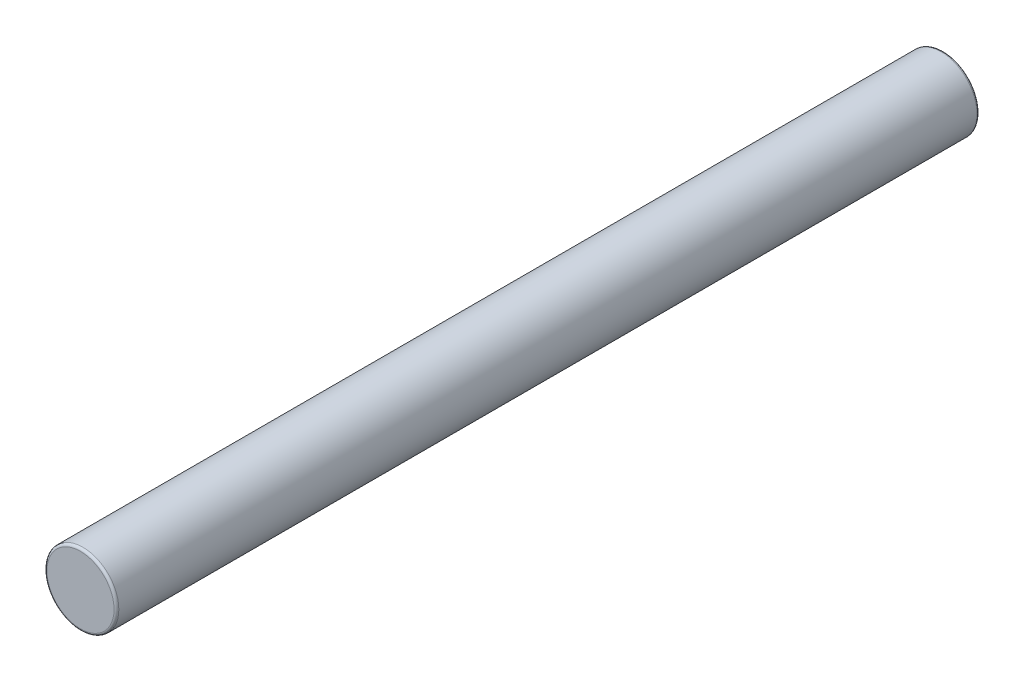
from build123d import *

# Parameters (mm, degrees)
SKETCH1_R      = 1.5
EXTRUDE1_DEPTH = 36
FILLET1_R      = 0.1


with BuildPart() as part:
    # Sketch1 → Extrude1 (new body)
    with BuildSketch(Plane.XY):
        Circle(SKETCH1_R)
    extrude(amount=EXTRUDE1_DEPTH)

    # Fillet1
    fillet1_edges = [part.edges().sort_by_distance(p)[0] for p in [
        (-1.5, 0, 0),
        (-1.5, 0, 36),
    ]]
    fillet(fillet1_edges, radius=FILLET1_R)


solid = part.part
